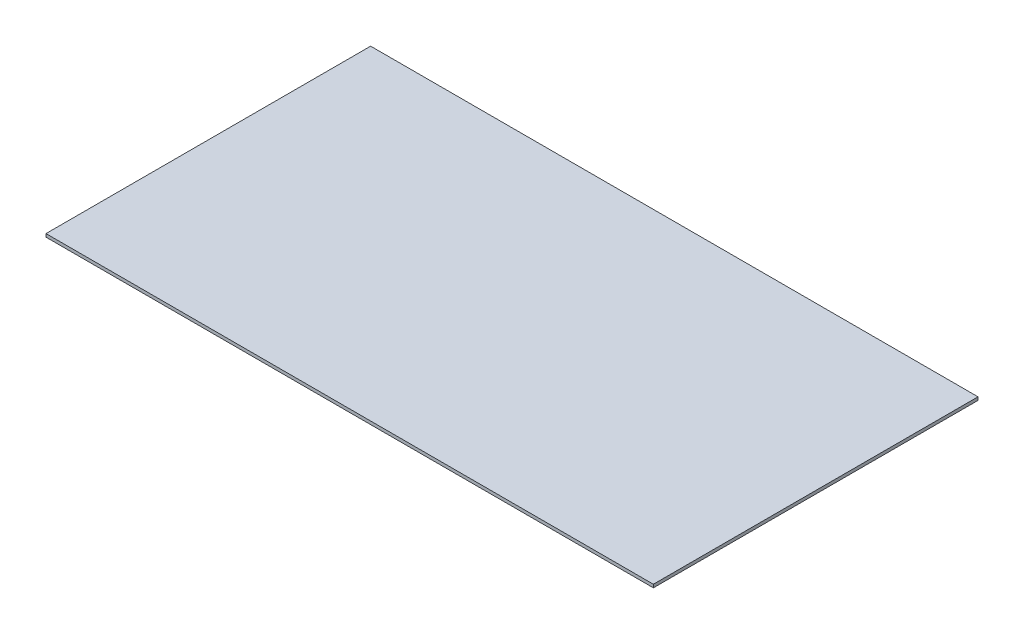
from build123d import *

# Parameters (mm, degrees)
SKETCH_1_W      = 580
SKETCH_1_H      = 310
EXTRUDE_1_DEPTH = 3


with BuildPart() as part:
    # 草图1 → 凸台-拉伸1 (new body)
    with BuildSketch(Plane(origin=(0, 0, 0), x_dir=(1, 0, 0), z_dir=(0, 1, 0))):
        Rectangle(SKETCH_1_W, SKETCH_1_H)
    extrude(amount=EXTRUDE_1_DEPTH)


solid = part.part
